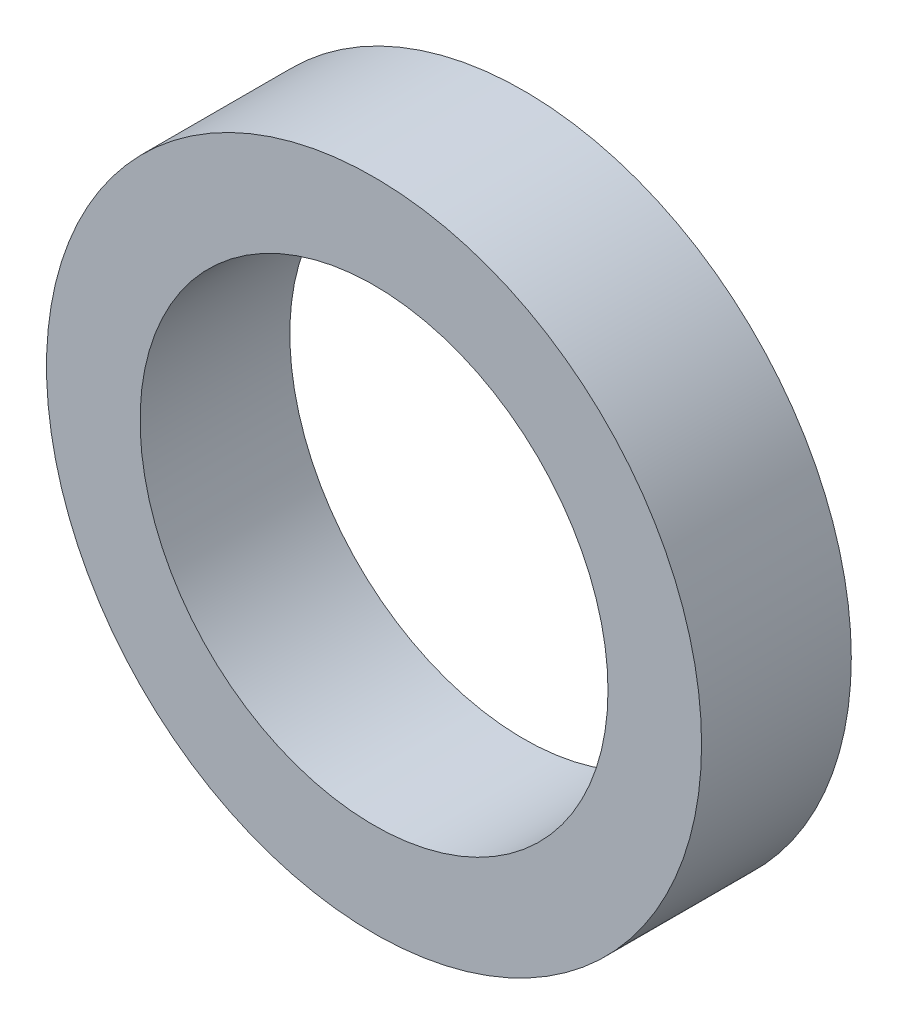
from build123d import *

# Parameters (mm, degrees)
SKETCH1_R           = 3.5
SKETCH1_R_2         = 2.5
BOSS_EXTRUDE1_DEPTH = 1.6


with BuildPart() as part:
    # Sketch1 → Boss-Extrude1 (new body)
    with BuildSketch(Plane.XY):
        Circle(SKETCH1_R)
        Circle(SKETCH1_R_2, mode=Mode.SUBTRACT)
    extrude(amount=BOSS_EXTRUDE1_DEPTH)


solid = part.part
